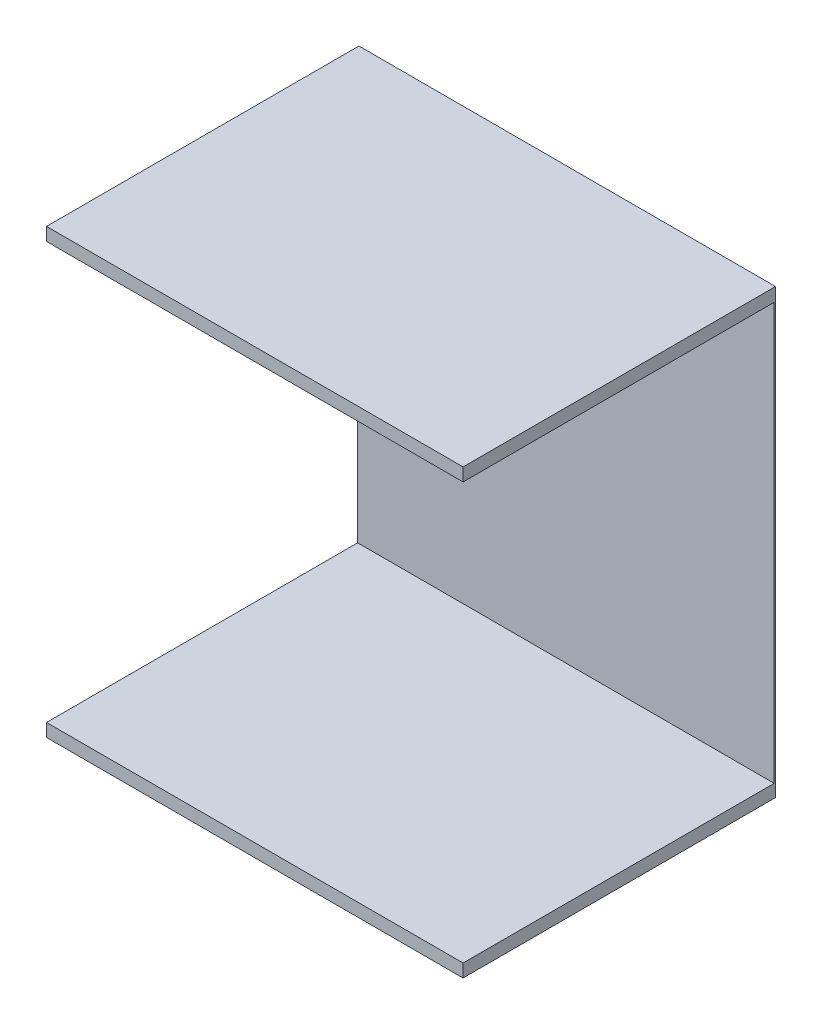
from build123d import *

# Parameters (mm, degrees)
SKETCH1_W             = 203.2
SKETCH1_H             = 6.35
BOSS_EXTRUDE1_DEPTH   = 152.4
BOSS_EXTRUDE1_2_DEPTH = 152.4
SKETCH3_W             = 203.2
SKETCH3_H             = 215.9
BOSS_EXTRUDE2_DEPTH   = 0.635


with BuildPart() as part:
    # Sketch1 → Boss-Extrude1 (new body)
    with BuildSketch(Plane.XY):
        with Locations((101.6, 3.175)):
            Rectangle(SKETCH1_W, SKETCH1_H)
    extrude(amount=BOSS_EXTRUDE1_DEPTH)



with BuildPart() as body_2:
    # Sketch1 → Boss-Extrude1 2 (new body)
    with BuildSketch(Plane.XY):
        with Locations((101.6, -206.375)):
            Rectangle(SKETCH1_W, SKETCH1_H)
    extrude(amount=BOSS_EXTRUDE1_2_DEPTH)


with BuildPart() as part_1:
    add(part.part)

    add(body_2.part)  # Boss-Extrude2 merges body 2
    # Sketch3 → Boss-Extrude2 (add)
    with BuildSketch(Plane(origin=(0, 0, 0), x_dir=(-1, 0, 0), z_dir=(0, 0, -1))):
        with Locations((-101.6, -101.6)):
            Rectangle(SKETCH3_W, SKETCH3_H)
    extrude(amount=-BOSS_EXTRUDE2_DEPTH)


solid = part_1.part
